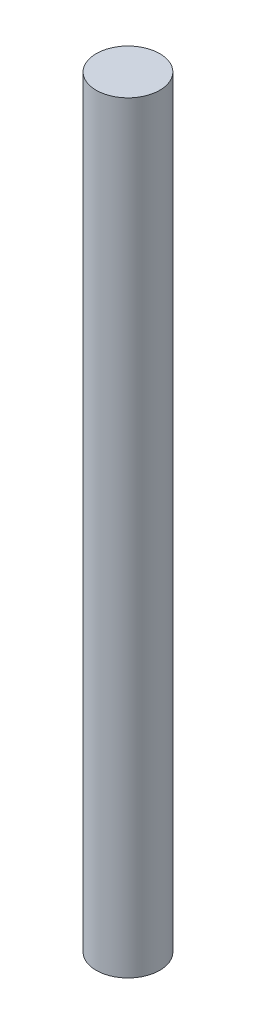
from build123d import *

# Parameters (mm, degrees)
SKETCH1_R           = 1.5875
BOSS_EXTRUDE1_DEPTH = 38.1


with BuildPart() as part:
    # Sketch1 → Boss-Extrude1 (new body)
    with BuildSketch(Plane(origin=(0, 0, 0), x_dir=(1, 0, 0), z_dir=(0, 1, 0))):
        with Locations(Location((0, 0, 0), (0, 0, 270))):
            Circle(SKETCH1_R)
    extrude(amount=BOSS_EXTRUDE1_DEPTH)


solid = part.part
